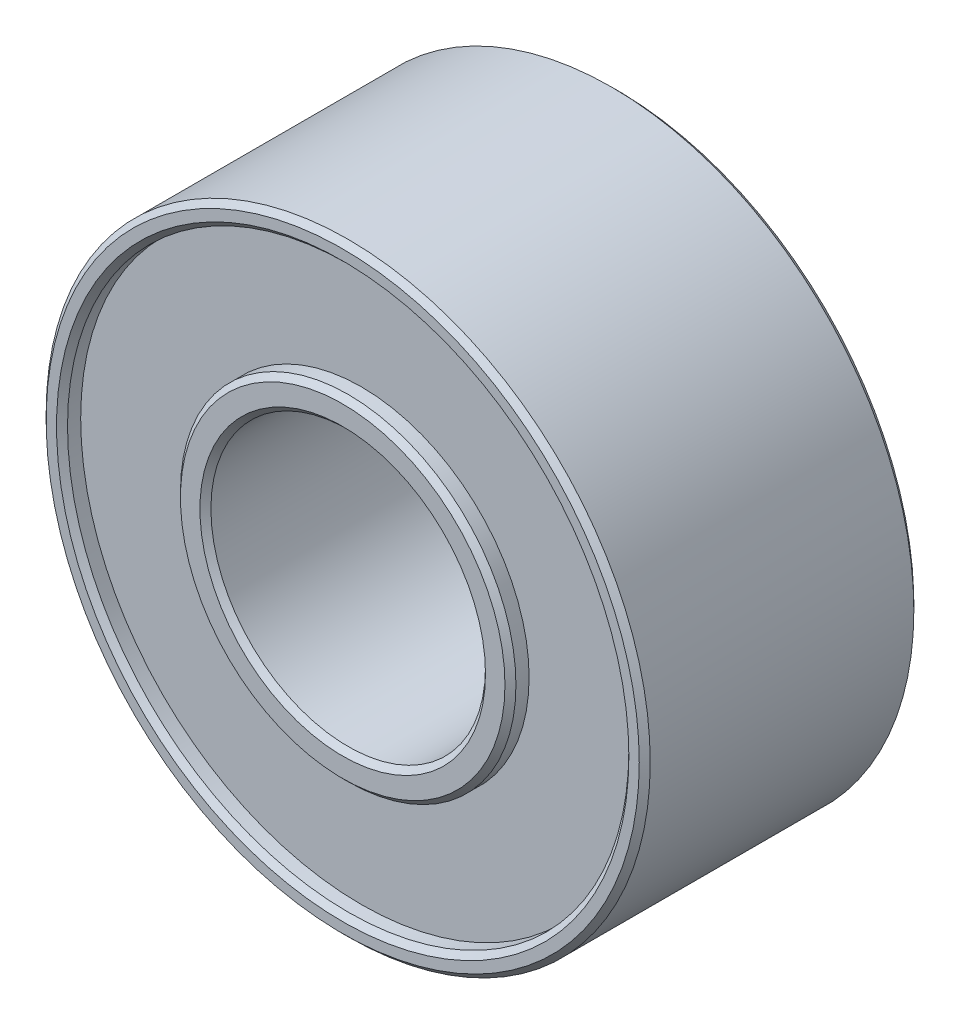
from build123d import *

# Parameters (mm, degrees)
CHAMFER1_SIZE = 0.1


with BuildPart() as part:
    # Sketch1 → Revolve1 (revolve)
    with BuildSketch(Plane(origin=(0, 0, 0), x_dir=(0, 0, -1), z_dir=(1, 0, 0)), mode=Mode.PRIVATE) as revolve1_sk:
        Polygon((-2.5, 5.5), (2.5, 5.5), (2.5, 5.110922442), (2.160325371, 5.110922442), (2.160325371, 3.054512243), (2.5, 3.054512243), (2.5, 2.5), (-2.5, 2.5), (-2.5, 3.054512243), (-2.160325371, 3.054512243), (-2.160325371, 5.110922442), (-2.5, 5.110922442), align=None)
    revolve(revolve1_sk.sketch.rotate(Axis((0, 0, -19.078271996), (0, 0, 1)), 90), axis=Axis((0, 0, -19.078271996), (0, 0, 1)))

    # Chamfer1
    chamfer1_edges = [part.edges().sort_by_distance(p)[0] for p in [
        (5.110922442, 0, 2.5),
        (5.5, 0, 2.5),
        (5.5, 0, -2.5),
        (5.110922442, 0, -2.5),
        (3.054512243, 0, -2.5),
        (2.5, 0, -2.5),
        (2.5, 0, 2.5),
        (3.054512243, 0, 2.5),
    ]]
    chamfer(chamfer1_edges, length=CHAMFER1_SIZE)


solid = part.part
